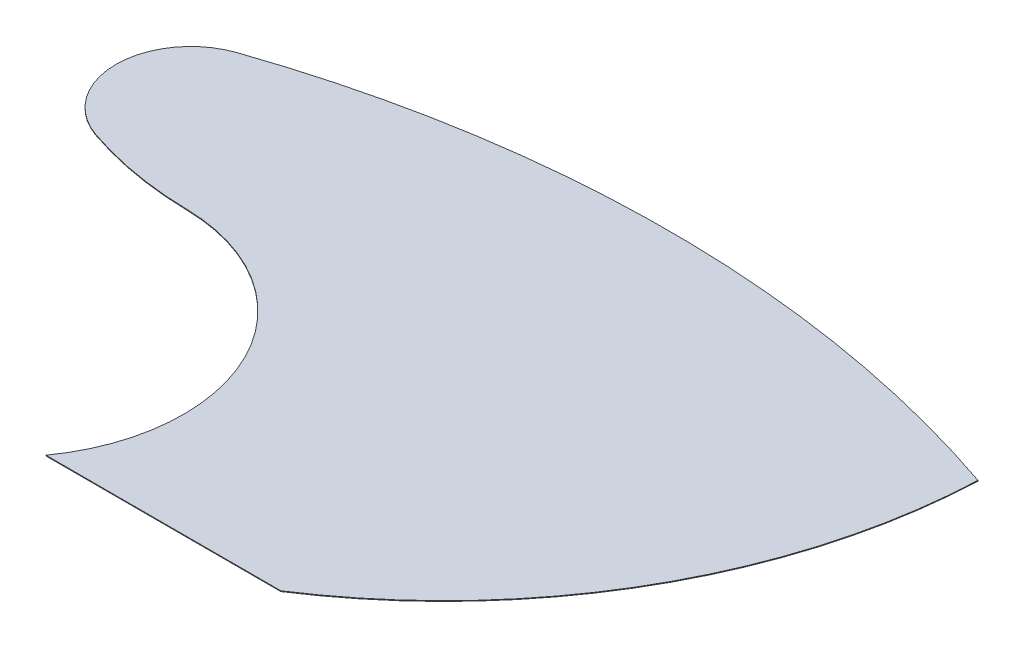
from build123d import *

# Parameters (mm, degrees)
BOSS_EXTRUDE1_DEPTH = 0.2


with BuildPart() as part:
    # Sketch1 → Boss-Extrude1 (new body)
    with BuildSketch(Plane(origin=(0, 0, 0), x_dir=(1, 0, 0), z_dir=(0, 1, 0))):
        with BuildLine():
            Line((77.011811156, 6.964256389), (142.011811156, 6.964256389))
            ThreePointArc((142.011811156, 6.964256389), (191.952101905, 59.934908511), (212.011811156, 129.917268368))
            ThreePointArc((212.011811156, 129.917268368), (109.511811156, 146.964256389), (7.011811156, 129.917268368))
            ThreePointArc((7.011811156, 129.917268368), (-6.988188844, 110.331559293), (7.011811156, 90.745850217))
            ThreePointArc((7.011811156, 90.745850217), (22.073659684, 86.875245478), (37.554181067, 85.393921812))
            ThreePointArc((37.554181067, 85.393921812), (80.985740192, 58.10383853), (77.011811156, 6.964256389))
        make_face()
    extrude(amount=BOSS_EXTRUDE1_DEPTH)


solid = part.part
